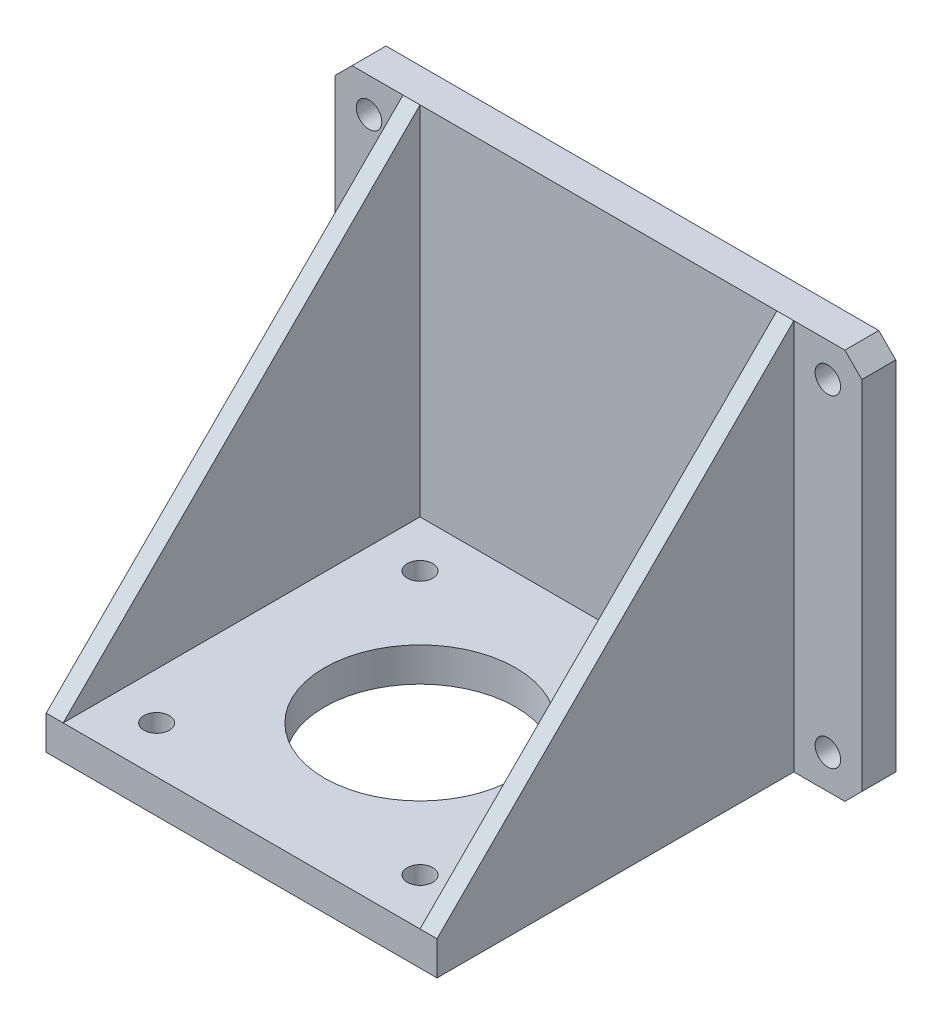
from build123d import *

# Parameters (mm, degrees)
SKETCH1_W           = 46
SKETCH1_H           = 46
BOSS_EXTRUDE1_DEPTH = 4
SKETCH2_W           = 46
SKETCH2_H           = 4
BOSS_EXTRUDE2_DEPTH = 42
SKETCH3_W           = 2
SKETCH3_H           = 42
BOSS_EXTRUDE3_DEPTH = 42
CHAMFER1_SIZE       = 42
SKETCH4_R           = 11.25
CUT_EXTRUDE1_DEPTH  = 42
SKETCH5_R           = 1.5
CUT_EXTRUDE2_DEPTH  = 42
SKETCH7_W           = 4
SKETCH7_H           = 46
BOSS_EXTRUDE4_DEPTH = 8
SKETCH8_W           = 4
SKETCH8_H           = 46
BOSS_EXTRUDE5_DEPTH = 8
CHAMFER2_SIZE       = 2
SKETCH6_R           = 1.5
CUT_EXTRUDE3_DEPTH  = 42


with BuildPart() as part:
    # Sketch1 → Boss-Extrude1 (new body)
    with BuildSketch(Plane(origin=(0, 0, 0), x_dir=(1, 0, 0), z_dir=(0, 1, 0))):
        with Locations((23, 23)):
            Rectangle(SKETCH1_W, SKETCH1_H)
    extrude(amount=BOSS_EXTRUDE1_DEPTH)

    # Sketch2 → Boss-Extrude2 (add)
    with BuildSketch(Plane(origin=(0, 4, 0), x_dir=(1, 0, 0), z_dir=(0, 1, 0))):
        with Locations((23, 44)):
            Rectangle(SKETCH2_W, SKETCH2_H)
    extrude(amount=BOSS_EXTRUDE2_DEPTH)

    # Sketch3 → Boss-Extrude3 (add)
    with BuildSketch(Plane(origin=(0, 4, 0), x_dir=(1, 0, 0), z_dir=(0, 1, 0))):
        with Locations((1, 21)):
            Rectangle(SKETCH3_W, SKETCH3_H)
        with Locations((45, 21)):
            Rectangle(SKETCH3_W, SKETCH3_H)
    extrude(amount=BOSS_EXTRUDE3_DEPTH)

    # Chamfer1
    chamfer1_edges = [part.edges().sort_by_distance(p)[0] for p in [
        (45, 46, 0),
        (1, 46, 0),
    ]]
    chamfer(chamfer1_edges, length=CHAMFER1_SIZE)

    # Sketch4 → Cut-Extrude1 (cut)
    with BuildSketch(Plane(origin=(0, 4, 0), x_dir=(1, 0, 0), z_dir=(0, 1, 0))):
        with Locations(Location((23, 21, 0), (0, 0, 270))):
            Circle(SKETCH4_R)
    extrude(amount=-CUT_EXTRUDE1_DEPTH, mode=Mode.SUBTRACT)

    # Sketch5 → Cut-Extrude2 (cut)
    with BuildSketch(Plane(origin=(0, 4, 0), x_dir=(1, 0, 0), z_dir=(0, 1, 0))):
        with Locations(Location((7.5, 36.5, 0), (0, 0, 270))):
            Circle(SKETCH5_R)
        with Locations(Location((7.5, 5.5, 0), (0, 0, 270))):
            Circle(SKETCH5_R)
        with Locations(Location((38.5, 5.5, 0), (0, 0, 270))):
            Circle(SKETCH5_R)
        with Locations(Location((38.5, 36.5, 0), (0, 0, 270))):
            Circle(SKETCH5_R)
    extrude(amount=-CUT_EXTRUDE2_DEPTH, mode=Mode.SUBTRACT)

    # Sketch7 → Boss-Extrude4 (add)
    with BuildSketch(Plane.ZY):
        with Locations((-44, 23)):
            Rectangle(SKETCH7_W, SKETCH7_H)
    extrude(amount=BOSS_EXTRUDE4_DEPTH)

    # Sketch8 → Boss-Extrude5 (add)
    with BuildSketch(Plane(origin=(46, 0, 0), x_dir=(0, 0, -1), z_dir=(1, 0, 0))):
        with Locations((44, 23)):
            Rectangle(SKETCH8_W, SKETCH8_H)
    extrude(amount=BOSS_EXTRUDE5_DEPTH)

    # Chamfer2
    chamfer2_edges = [part.edges().sort_by_distance(p)[0] for p in [
        (54, 46, -44),
        (54, 0, -44),
        (-8, 0, -44),
        (-8, 46, -44),
    ]]
    chamfer(chamfer2_edges, length=CHAMFER2_SIZE)

    # Sketch6 → Cut-Extrude3 (cut)
    with BuildSketch(Plane.XY.offset(-42)):
        with Locations((-4, 42)):
            Circle(SKETCH6_R)
        with Locations((-4, 4)):
            Circle(SKETCH6_R)
        with Locations((50, 4)):
            Circle(SKETCH6_R)
        with Locations((50, 42)):
            Circle(SKETCH6_R)
    extrude(amount=-CUT_EXTRUDE3_DEPTH, mode=Mode.SUBTRACT)


solid = part.part
